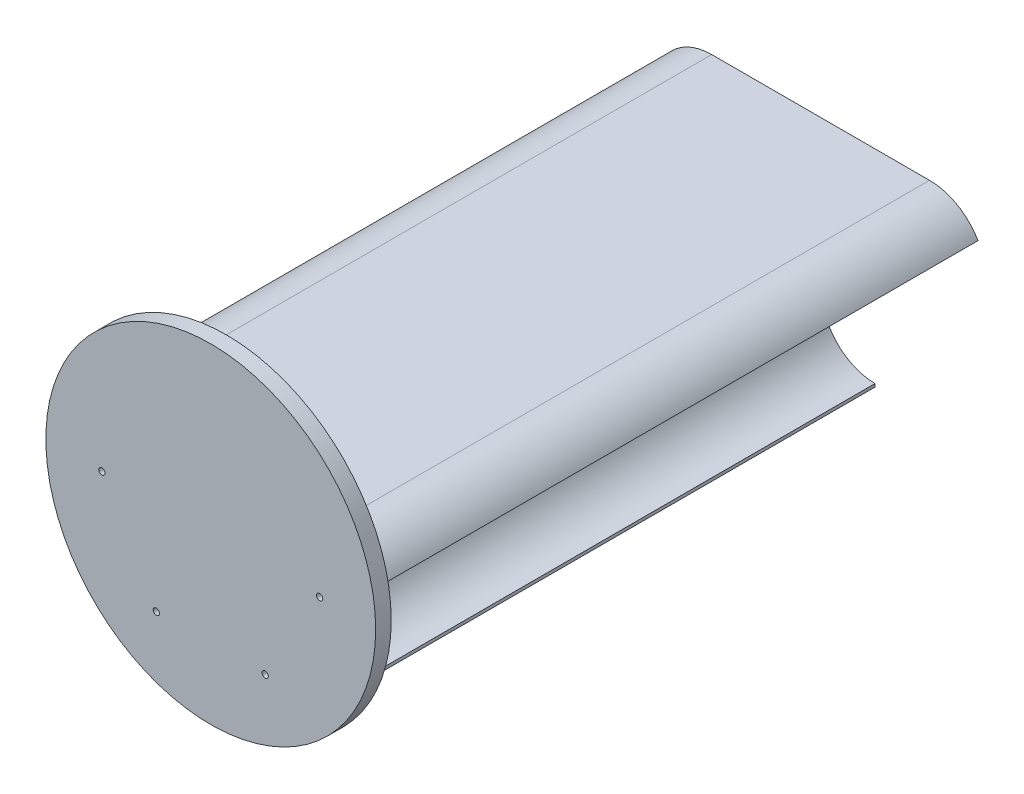
from build123d import *

# Parameters (mm, degrees)
BOSS_EXTRU_1_DEPTH      = 191
ENL_V_MAT_EXTRU_1_DEPTH = 204.406327378
ESQUISSE2_R             = 53
ESQUISSE2_R_2           = 1
BOSS_EXTRU_2_DEPTH      = 5
BOSS_EXTRU_3_DEPTH      = 7
BOSS_EXTRU_4_DEPTH      = 7


with BuildPart() as part:
    # Esquisse1 → Boss.-Extru.1 (new body)
    with BuildSketch(Plane.XY):
        with BuildLine():
            Line((-17.5, -48.310889132), (-17.5, -47.310889132))
            ThreePointArc((-17.5, -47.310889132), (-9, -15.588457268), (-32.222431864, -38.810889132))
            Line((-32.222431864, -38.810889132), (-33.088457268, -39.310889132))
            ThreePointArc((-33.088457268, -39.310889132), (-35.314540075, -27.733649929), (-29.89862988, -17.26198201))
            ThreePointArc((-29.89862988, -17.26198201), (-41.675315415, -16.716463864), (-50.588457268, -9))
            Line((-50.588457268, -9), (-49.722431864, -8.5))
            ThreePointArc((-49.722431864, -8.5), (-18, 0), (-49.722431864, 8.5))
            Line((-49.722431864, 8.5), (-50.588457268, 9))
            ThreePointArc((-50.588457268, 9), (-44, 15.588457268), (-35, 18))
            Line((-35, 18), (35, 18))
            ThreePointArc((35, 18), (44, 15.588457268), (50.588457268, 9))
            Line((50.588457268, 9), (49.722431864, 8.5))
            ThreePointArc((49.722431864, 8.5), (18, 0), (49.722431864, -8.5))
            Line((49.722431864, -8.5), (50.588457268, -9))
            ThreePointArc((50.588457268, -9), (41.675315415, -16.716463864), (29.89862988, -17.26198201))
            ThreePointArc((29.89862988, -17.26198201), (35.314540075, -27.733649929), (33.088457268, -39.310889132))
            Line((33.088457268, -39.310889132), (32.222431864, -38.810889132))
            ThreePointArc((32.222431864, -38.810889132), (9, -15.588457268), (17.5, -47.310889132))
            Line((17.5, -47.310889132), (17.5, -48.310889132))
            ThreePointArc((17.5, -48.310889132), (6.36077534, -44.450113792), (0, -34.523964019))
            ThreePointArc((0, -34.523964019), (-6.36077534, -44.450113792), (-17.5, -48.310889132))
        make_face()
    extrude(amount=BOSS_EXTRU_1_DEPTH)

    # Esquisse4 → Enlèv. mat.-Extru.1 (cut, through all)
    with BuildSketch(Plane.XY.offset(191)):
        Polygon((11.259686126, -14.497651553), (18.185177603, -2.502348447), (49.722431864, -8.5), (50.588457268, -9), (33.088457268, -39.310889132), (32.222431864, -38.810889132), align=None)
        Polygon((-33.088457268, -39.310889132), (-32.222431864, -38.810889132), (-11.259686126, -14.497651553), (-18.185177603, -2.502348447), (-49.722431864, -8.5), (-50.588457268, -9), align=None)
    extrude(amount=-ENL_V_MAT_EXTRU_1_DEPTH, mode=Mode.SUBTRACT)

    # Esquisse2 → Boss.-Extru.2 (add)
    with BuildSketch(Plane.XY.offset(191)):
        Circle(ESQUISSE2_R)
        with Locations((-35, 0)):
            Circle(ESQUISSE2_R_2, mode=Mode.SUBTRACT)
        with Locations((-17.5, -30.310889132)):
            Circle(ESQUISSE2_R_2, mode=Mode.SUBTRACT)
        with Locations((17.5, -30.310889132)):
            Circle(ESQUISSE2_R_2, mode=Mode.SUBTRACT)
        with Locations((35, 0)):
            Circle(ESQUISSE2_R_2, mode=Mode.SUBTRACT)
        Polygon((41.674038106, 8.559773091), (35.611860279, 12.059773091), (36.611860279, 13.791823898), (42.674038106, 10.291823898), align=None, mode=Mode.SUBTRACT)
        Polygon((7.361860279, -36.870662223), (6.361860279, -38.602713031), (12.424038106, -42.102713031), (13.424038106, -40.370662223), align=None, mode=Mode.SUBTRACT)
        Polygon((-35.611860279, 12.059773091), (-36.611860279, 13.791823898), (-42.674038106, 10.291823898), (-41.674038106, 8.559773091), align=None, mode=Mode.SUBTRACT)
        Polygon((-7.361860279, -36.870662223), (-6.361860279, -38.602713031), (-12.424038106, -42.102713031), (-13.424038106, -40.370662223), align=None, mode=Mode.SUBTRACT)
    extrude(amount=BOSS_EXTRU_2_DEPTH)

    # Esquisse5 → Boss.-Extru.3 (add)
    with BuildSketch(Plane(origin=(21.486860279, -12.405444566, 0), x_dir=(0, 0, -1), z_dir=(0.8660254037844384, -0.5000000000000006, 0))):
        Polygon((-196, -28.25), (-190.4, -28.25), (-190.4, -26.25), (-188.4, -26.25), (-188.4, -28.25), (-188.4, -30.25), (-196, -30.25), align=None)
        Polygon((-190.4, 26.25), (-188.4, 26.25), (-188.4, 28.25), (-188.4, 30.25), (-196, 30.25), (-196, 28.25), (-190.4, 28.25), align=None)
    extrude(amount=BOSS_EXTRU_3_DEPTH)

    # Esquisse6 → Boss.-Extru.4 (add)
    with BuildSketch(Plane(origin=(-21.486860279, -12.405444566, 0), x_dir=(0, 0, 1), z_dir=(-0.8660254037844384, -0.5000000000000006, 0))):
        Polygon((196, -28.25), (190.4, -28.25), (190.4, -26.25), (188.4, -26.25), (188.4, -28.25), (188.4, -30.25), (196, -30.25), align=None)
        Polygon((190.4, 26.25), (188.4, 26.25), (188.4, 28.25), (188.4, 30.25), (196, 30.25), (196, 28.25), (190.4, 28.25), align=None)
    extrude(amount=BOSS_EXTRU_4_DEPTH)


solid = part.part
